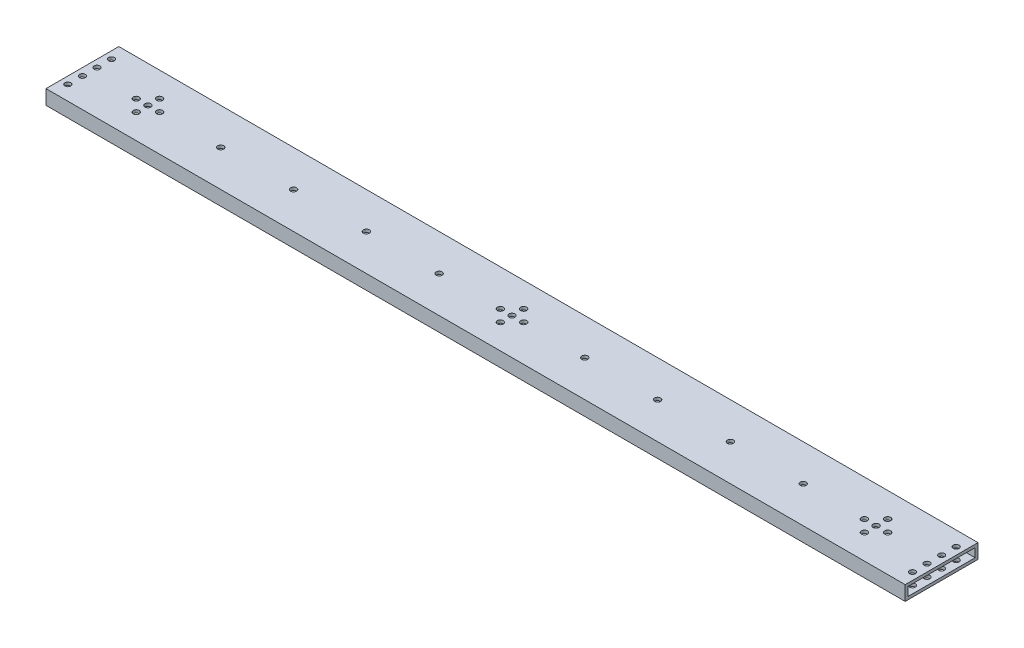
from build123d import *

# Parameters (mm, degrees)
SKETCH_1_W          = 700
SKETCH_1_H          = 50
EXTRUDE_1_DEPTH     = 10
SKETCH_2_R          = 2.05
CUT_EXTRUDE_2_DEPTH = 352.034186369
SKETCH_3_R          = 2.05
CUT_EXTRUDE_3_DEPTH = 352.034186369
SKETCH_4_W          = 46
SKETCH_4_H          = 6
CUT_EXTRUDE_4_DEPTH = 701.51766573
SKETCH_6_W          = 50
SKETCH_6_H          = 10
CUT_EXTRUDE_6_DEPTH = 5
SKETCH_7_R          = 2
CUT_EXTRUDE_7_DEPTH = 347.04912946
SKETCH_8_W          = 50
SKETCH_8_H          = 10
CUT_EXTRUDE_8_DEPTH = 50


with BuildPart() as part:
    # 草图1 → 凸台-拉伸1 (new body)
    with BuildSketch(Plane(origin=(0, 0, 0), x_dir=(1, 0, 0), z_dir=(0, 1, 0))):
        Rectangle(SKETCH_1_W, SKETCH_1_H)
    extrude(amount=EXTRUDE_1_DEPTH)

    # 草图2 → 切除-拉伸2 (cut, through all)
    with BuildSketch(Plane(origin=(0, 10, 0), x_dir=(1, 0, 0), z_dir=(0, 1, 0))):
        with Locations(Location((-300, 0, 0), (0, 0, 270))):
            Circle(SKETCH_2_R)
        with Locations(Location((-250, 0, 0), (0, 0, 270))):
            Circle(SKETCH_2_R)
        with Locations(Location((-200, 0, 0), (0, 0, 270))):
            Circle(SKETCH_2_R)
        with Locations(Location((-150, 0, 0), (0, 0, 270))):
            Circle(SKETCH_2_R)
        with Locations(Location((-100, 0, 0), (0, 0, 270))):
            Circle(SKETCH_2_R)
        with Locations(Location((-50, 0, 0), (0, 0, 270))):
            Circle(SKETCH_2_R)
        with Locations(Location((0, 0, 0), (0, 0, 270))):
            Circle(SKETCH_2_R)
        with Locations(Location((50, 0, 0), (0, 0, 270))):
            Circle(SKETCH_2_R)
        with Locations(Location((100, 0, 0), (0, 0, 270))):
            Circle(SKETCH_2_R)
        with Locations(Location((150, 0, 0), (0, 0, 270))):
            Circle(SKETCH_2_R)
        with Locations(Location((200, 0, 0), (0, 0, 270))):
            Circle(SKETCH_2_R)
        with Locations(Location((250, 0, 0), (0, 0, 270))):
            Circle(SKETCH_2_R)
        with Locations(Location((300, 0, 0), (0, 0, 270))):
            Circle(SKETCH_2_R)
    extrude(amount=-CUT_EXTRUDE_2_DEPTH, mode=Mode.SUBTRACT)

    # 草图3 → 切除-拉伸3 (cut, through all)
    with BuildSketch(Plane(origin=(0, 10, 0), x_dir=(1, 0, 0), z_dir=(0, 1, 0))):
        with Locations(Location((-242, 0, 0), (0, 0, 270))):
            Circle(SKETCH_3_R)
        with Locations(Location((-258, 0, 0), (0, 0, 270))):
            Circle(SKETCH_3_R)
        with Locations(Location((-8, 0, 0), (0, 0, 270))):
            Circle(SKETCH_3_R)
        with Locations(Location((8, 0, 0), (0, 0, 270))):
            Circle(SKETCH_3_R)
        with Locations(Location((242, 0, 0), (0, 0, 270))):
            Circle(SKETCH_3_R)
        with Locations(Location((258, 0, 0), (0, 0, 270))):
            Circle(SKETCH_3_R)
        with Locations(Location((-250, 8, 0), (0, 0, 270))):
            Circle(SKETCH_3_R)
        with Locations(Location((-250, -8, 0), (0, 0, 270))):
            Circle(SKETCH_3_R)
        with Locations(Location((0, 8, 0), (0, 0, 270))):
            Circle(SKETCH_3_R)
        with Locations(Location((0, -8, 0), (0, 0, 270))):
            Circle(SKETCH_3_R)
        with Locations(Location((250, 8, 0), (0, 0, 270))):
            Circle(SKETCH_3_R)
        with Locations(Location((250, -8, 0), (0, 0, 270))):
            Circle(SKETCH_3_R)
    extrude(amount=-CUT_EXTRUDE_3_DEPTH, mode=Mode.SUBTRACT)

    # 草图4 → 切除-拉伸4 (cut, through all)
    with BuildSketch(Plane.ZY.offset(350)):
        with Locations((0, 5)):
            Rectangle(SKETCH_4_W, SKETCH_4_H)
    extrude(amount=-CUT_EXTRUDE_4_DEPTH, mode=Mode.SUBTRACT)

    # 草图6 → 切除-拉伸6 (cut)
    with BuildSketch(Plane(origin=(350, 0, 0), x_dir=(0, 0, -1), z_dir=(1, 0, 0))):
        with Locations((0, 5)):
            Rectangle(SKETCH_6_W, SKETCH_6_H)
    cut_extrude_6 = extrude(amount=-CUT_EXTRUDE_6_DEPTH, mode=Mode.SUBTRACT)

    # 镜向1: 切除-拉伸6 across plane
    add(cut_extrude_6.mirror(Plane(origin=(0, 0, 0), x_dir=(0, 0, 1), z_dir=(1, 0, 0))), mode=Mode.SUBTRACT)

    # 草图7 → 切除-拉伸7 (cut, through all)
    with BuildSketch(Plane(origin=(0, 10, 0), x_dir=(1, 0, 0), z_dir=(0, 1, 0))):
        with Locations(Location((340, 15, 0), (0, 0, 270))):
            Circle(SKETCH_7_R)
        with Locations(Location((340, 5, 0), (0, 0, 270))):
            Circle(SKETCH_7_R)
        with Locations(Location((340, -5, 0), (0, 0, 270))):
            Circle(SKETCH_7_R)
        with Locations(Location((340, -15, 0), (0, 0, 270))):
            Circle(SKETCH_7_R)
        with Locations(Location((290, 5, 0), (0, 0, 270))):
            Circle(SKETCH_7_R)
        with Locations(Location((290, 15, 0), (0, 0, 270))):
            Circle(SKETCH_7_R)
        with Locations(Location((290, -5, 0), (0, 0, 270))):
            Circle(SKETCH_7_R)
        with Locations(Location((290, -15, 0), (0, 0, 270))):
            Circle(SKETCH_7_R)
    cut_extrude_7 = extrude(amount=-CUT_EXTRUDE_7_DEPTH, mode=Mode.SUBTRACT)

    # 镜向2: 切除-拉伸7 across plane
    add(cut_extrude_7.mirror(Plane(origin=(0, 0, 0), x_dir=(0, 0, 1), z_dir=(1, 0, 0))), mode=Mode.SUBTRACT)

    # 草图8 → 切除-拉伸8 (cut)
    with BuildSketch(Plane(origin=(345, 0, 0), x_dir=(0, 0, -1), z_dir=(1, 0, 0))):
        with Locations((0, 5)):
            Rectangle(SKETCH_8_W, SKETCH_8_H)
    cut_extrude_8 = extrude(amount=-CUT_EXTRUDE_8_DEPTH, mode=Mode.SUBTRACT)

    # 镜向3: 切除-拉伸8 across plane
    add(cut_extrude_8.mirror(Plane(origin=(0, 0, 0), x_dir=(0, 0, 1), z_dir=(1, 0, 0))), mode=Mode.SUBTRACT)


solid = part.part
